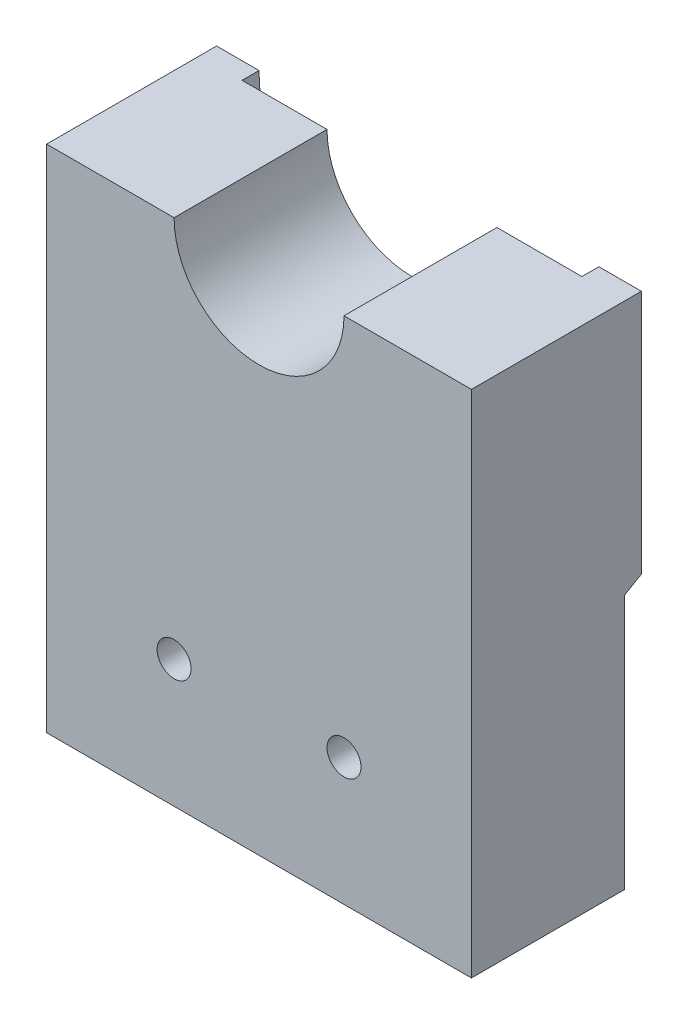
from build123d import *

# Parameters (mm, degrees)
SKETCH1_W           = 25
SKETCH1_H           = 30
BOSS_EXTRUDE1_DEPTH = 10
CUT_EXTRUDE1_DEPTH  = 41.311288741
CUT_EXTRUDE2_DEPTH  = 1
CUT_EXTRUDE3_DEPTH  = 41.074929819
SKETCH5_R           = 1
CUT_EXTRUDE5_DEPTH  = 41.074929819


with BuildPart() as part:
    # Sketch1 → Boss-Extrude1 (new body)
    with BuildSketch(Plane.XY):
        with Locations((12.5, 15)):
            Rectangle(SKETCH1_W, SKETCH1_H)
    extrude(amount=BOSS_EXTRUDE1_DEPTH)

    # Sketch2 → Cut-Extrude1 (cut, through all)
    with BuildSketch(Plane(origin=(25, 0, 0), x_dir=(0, 0, -1), z_dir=(1, 0, 0))):
        Polygon((0, 15.577350269), (-1, 15), (-1, 0), (0, 0), align=None)
    extrude(amount=-CUT_EXTRUDE1_DEPTH, mode=Mode.SUBTRACT)

    # Sketch3 → Cut-Extrude2 (cut)
    with BuildSketch(Plane(origin=(0, 0, 0), x_dir=(-1, 0, 0), z_dir=(0, 0, -1))):
        with BuildLine():
            Line((-22.5, 30), (-2.5, 30))
            ThreePointArc((-2.5, 30), (-12.5, 20), (-22.5, 30))
        make_face()
    extrude(amount=-CUT_EXTRUDE2_DEPTH, mode=Mode.SUBTRACT)

    # Sketch4 → Cut-Extrude3 (cut, through all)
    with BuildSketch(Plane(origin=(0, 0, 1), x_dir=(-1, 0, 0), z_dir=(0, 0, -1))):
        with BuildLine():
            Line((-7.5, 30), (-17.5, 30))
            ThreePointArc((-17.5, 30), (-12.5, 25), (-7.5, 30))
        make_face()
    extrude(amount=-CUT_EXTRUDE3_DEPTH, mode=Mode.SUBTRACT)

    # Sketch5 → Cut-Extrude5 (cut, through all)
    with BuildSketch(Plane(origin=(0, 0, 1), x_dir=(-1, 0, 0), z_dir=(0, 0, -1))):
        with Locations(Location((-17.5, 7.5, 0), (0, 0, 90))):
            Circle(SKETCH5_R)
        with Locations(Location((-7.5, 7.5, 0), (0, 0, 270))):
            Circle(SKETCH5_R)
    extrude(amount=-CUT_EXTRUDE5_DEPTH, mode=Mode.SUBTRACT)


solid = part.part
